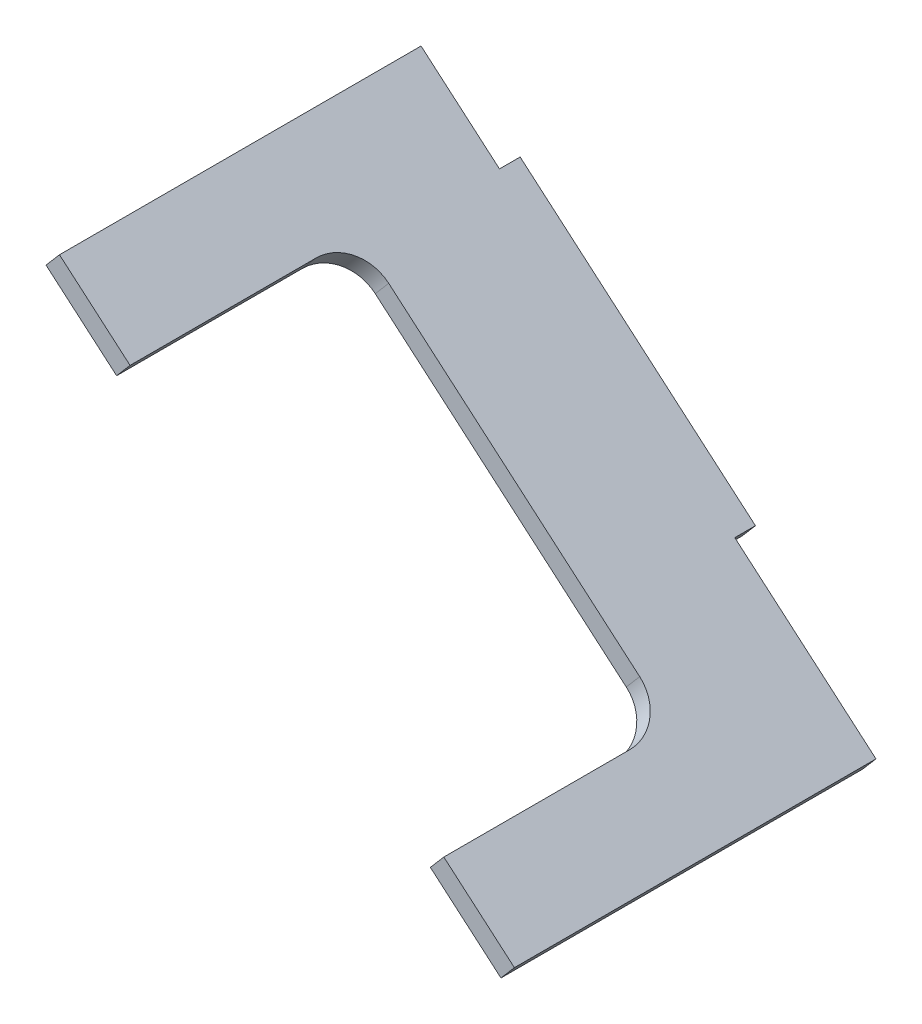
from build123d import *

# Parameters (mm, degrees)
ESTRUSIONE_ESTRUSIONE1_DEPTH      = 35
ESTRUSIONE_ESTRUSIONE1_DEPTH_BACK = 2
SCHIZZO2_W                        = 10
SCHIZZO2_H                        = 35
SCHIZZO2_W_2                      = 18
ESTRUSIONE_ESTRUSIONE2_DEPTH      = 2
SCHIZZO3_W                        = 40
SCHIZZO3_H                        = 22
TAGLIO_ESTRUSIONE1_DEPTH          = 10
RACCORDO1_R                       = 4


with BuildPart() as part:
    # Schizzo1 → Estrusione-Estrusione1 (new, two sides: drawn at the far end of the back side and taken through both)
    with BuildSketch(Plane.XY.offset(-ESTRUSIONE_ESTRUSIONE1_DEPTH_BACK)):
        Polygon((54.746042814, 47.033828684), (31.967868601, 66.557014374), (30.666322888, 65.038469427), (53.444497101, 45.515283736), align=None)
    extrude(amount=ESTRUSIONE_ESTRUSIONE1_DEPTH + ESTRUSIONE_ESTRUSIONE1_DEPTH_BACK)

    # Schizzo2 → Estrusione-Estrusione2 (add)
    with BuildSketch(Plane(origin=(45.123763451, 52.64698914, 0), x_dir=(0.7592724737758618, -0.6507728563533387, 0), z_dir=(-0.6507728563533387, -0.7592724737758618, 0))):
        with Locations((-24.041175681, 17.5)):
            Rectangle(SCHIZZO2_W, SCHIZZO2_H)
        with Locations((19.958824319, 17.5)):
            Rectangle(SCHIZZO2_W_2, SCHIZZO2_H)
    extrude(amount=-ESTRUSIONE_ESTRUSIONE2_DEPTH)

    # Schizzo3 → Taglio-Estrusione1 (cut)
    with BuildSketch(Plane(origin=(46.425309163, 54.165534088, 0), x_dir=(0.759272473775862, -0.6507728563533386, 0), z_dir=(0.6507728563533387, 0.759272473775862, 0))):
        with Locations((-0.041175681, -24)):
            Rectangle(SCHIZZO3_W, SCHIZZO3_H)
    extrude(amount=-TAGLIO_ESTRUSIONE1_DEPTH, mode=Mode.SUBTRACT)

    # Raccordo1
    raccordo1_edges = [part.edges().sort_by_distance(p)[0] for p in [
        (30.55782327, 66.448514757, 13),
        (60.928722221, 40.417600503, 13),
    ]]
    fillet(raccordo1_edges, radius=RACCORDO1_R)


solid = part.part
